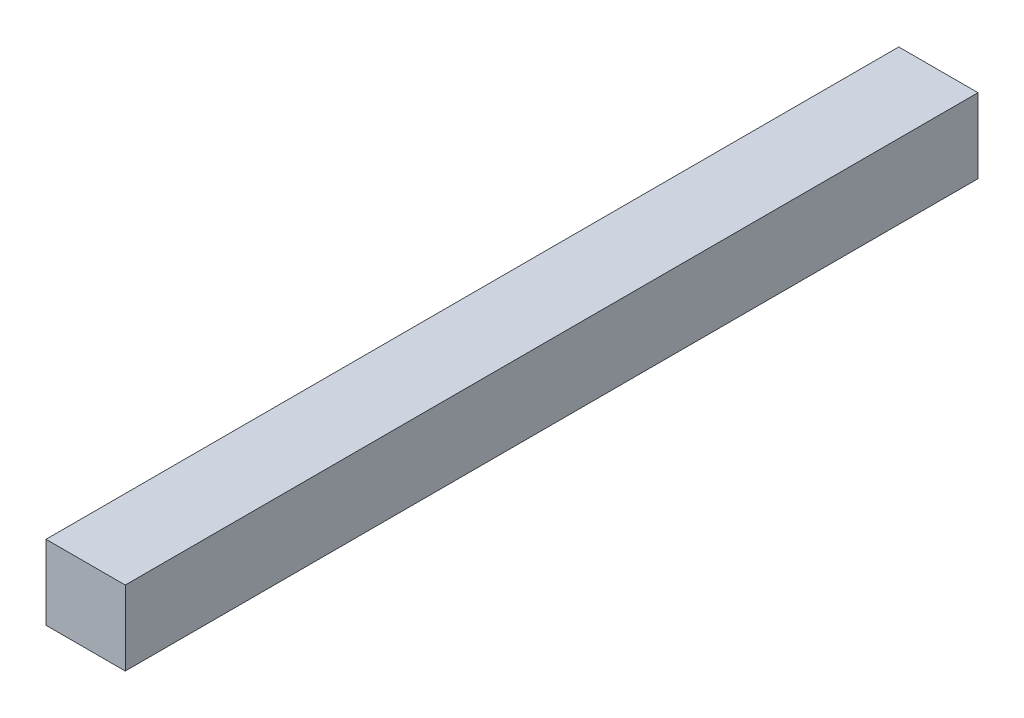
from build123d import *

# Parameters (mm, degrees)
SKETCH1_W           = 50
SKETCH1_H           = 47
BOSS_EXTRUDE1_DEPTH = 538


with BuildPart() as part:
    # Sketch1 → Boss-Extrude1 (new body)
    with BuildSketch(Plane.XY):
        with Locations((-1.666666667, 1.651515152)):
            Rectangle(SKETCH1_W, SKETCH1_H)
    extrude(amount=BOSS_EXTRUDE1_DEPTH)


solid = part.part
